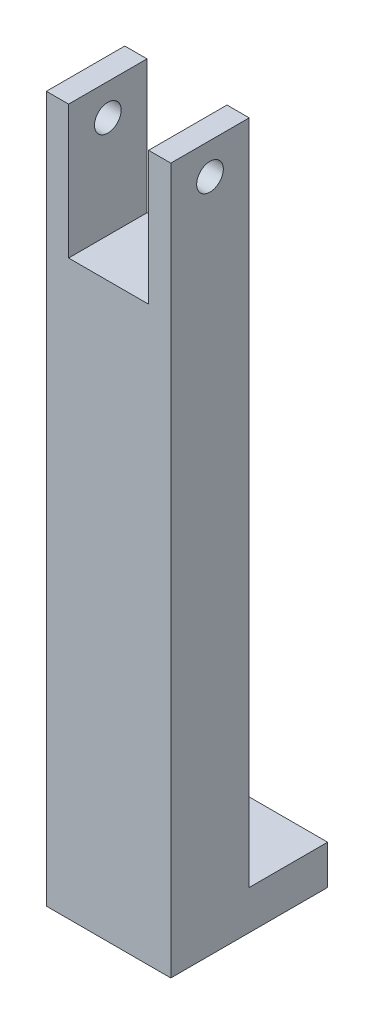
from build123d import *

# Parameters (mm, degrees)
Y_KSEKLIK_EKSTR_ZYON1_DEPTH      = 10
Y_KSEKLIK_EKSTR_ZYON2_DEPTH      = 10
Y_KSEKLIK_EKSTR_ZYON2_DEPTH_BACK = 10
IZIM3_W                          = 15.866666667
IZIM3_H                          = 5
IZIM5_R                          = 1.7
KES_EKSTR_ZYON1_DEPTH            = 36
IZIM9_R                          = 1.7
KES_EKSTR_ZYON2_DEPTH            = 36


with BuildPart() as part:
    # Çizim2 → Yükseklik-Ekstrüzyon1 (new body)
    with BuildSketch(Plane.XY):
        Polygon((0, 0), (0, 79.333333333), (0, 85), (2.833333333, 85), (2.833333333, 68), (13.033333333, 68), (13.033333333, 85), (15.866666667, 85), (15.866666667, 79.333333333), (15.866666667, 0), align=None)
    extrude(amount=Y_KSEKLIK_EKSTR_ZYON1_DEPTH)

    # Çizim3 → Yükseklik-Ekstrüzyon2 (add, two sides: drawn at the far end of the back side and taken through both)
    with BuildSketch(Plane(origin=(0, 0, 0), x_dir=(-1, 0, 0), z_dir=(0, 0, -1)).offset(-Y_KSEKLIK_EKSTR_ZYON2_DEPTH_BACK)):
        with Locations((-7.933333334, -2.5)):
            Rectangle(IZIM3_W, IZIM3_H)
    extrude(amount=Y_KSEKLIK_EKSTR_ZYON2_DEPTH + Y_KSEKLIK_EKSTR_ZYON2_DEPTH_BACK)

    # Çizim5 → Kes-Ekstrüzyon1 (cut)
    with BuildSketch(Plane(origin=(15.866666667, 0, 0), x_dir=(0, 0, -1), z_dir=(1, 0, 0))):
        with Locations((-5, 81)):
            Circle(IZIM5_R)
    extrude(amount=-KES_EKSTR_ZYON1_DEPTH, mode=Mode.SUBTRACT)

    # Çizim9 → Kes-Ekstrüzyon2 (cut)
    with BuildSketch(Plane(origin=(0, 0, 0), x_dir=(1, 0, 0), z_dir=(0, 1, 0))):
        with Locations(Location((7.933333333, 5, 0), (0, 0, 270))):
            Circle(IZIM9_R)
    extrude(amount=-KES_EKSTR_ZYON2_DEPTH, mode=Mode.SUBTRACT)


solid = part.part
